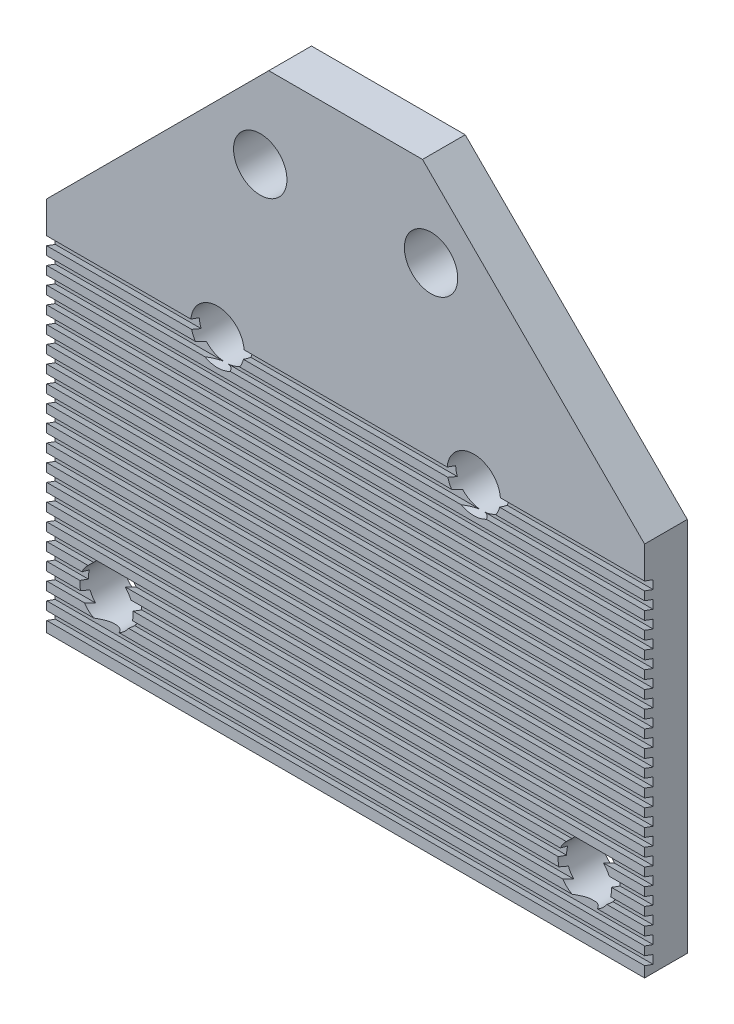
from build123d import *

# Parameters (mm, degrees)
SKETCH1_W                   = 88.9
SKETCH1_H                   = 88.9
BOSS_EXTRUDE1_DEPTH         = 3.175
TAP_DRILL_FOR_3_8_16_TAP2_D = 7.9375
CHAMFER1_SIZE               = 33.02
CUT_EXTRUDE6_DEPTH          = 63.941922635
LPATTERN2_COUNT             = 20
LPATTERN2_PITCH             = 2.54


with BuildPart() as part:
    # Sketch1 → Boss-Extrude1 (new, symmetric)
    with BuildSketch(Plane.XY):
        Rectangle(SKETCH1_W, SKETCH1_H)
    extrude(amount=BOSS_EXTRUDE1_DEPTH, both=True)

    # Tap Drill for 3/8-16 Tap2 (through all)
    with Locations(Plane.XY.offset(3.175)):
        with Locations((-12.7, 31.75), (12.7, 31.75), (19.05, 6.35), (-19.05, 6.35), (-35.56, -35.56), (35.56, -35.56)):
            Hole(TAP_DRILL_FOR_3_8_16_TAP2_D / 2)

    # Chamfer1
    chamfer1_edges = [part.edges().sort_by_distance(p)[0] for p in [
        (-44.45, 44.45, 0),
        (44.45, 44.45, 0),
    ]]
    chamfer(chamfer1_edges, length=CHAMFER1_SIZE)

    # Sketch9 → Cut-Extrude6 (cut, symmetric)
    with BuildSketch(Plane.ZY):
        Polygon((3.175, -42.8625), (1.905, -43.324742198), (1.905, -42.054742198), (3.175, -41.5925), align=None)
    cut_extrude6 = extrude(amount=CUT_EXTRUDE6_DEPTH, both=True, mode=Mode.SUBTRACT)

    # LPattern2: Cut-Extrude6 ×20
    with Locations(*[(0, i * LPATTERN2_PITCH, 0) for i in range(1, LPATTERN2_COUNT)]):
        add(cut_extrude6, mode=Mode.SUBTRACT)


solid = part.part
